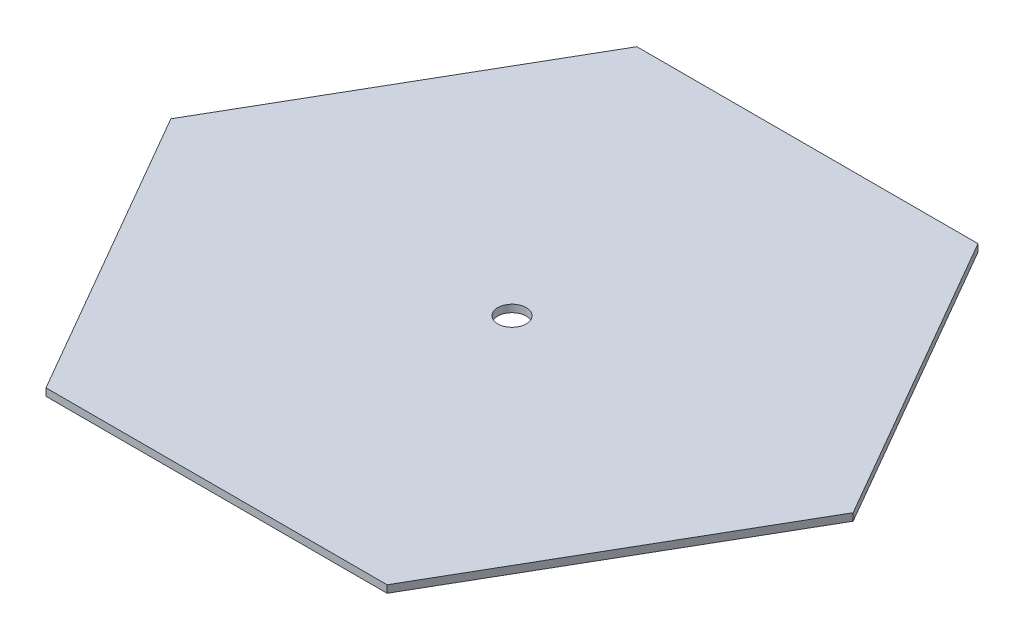
from build123d import *

# Parameters (mm, degrees)
BOSS_EXTRUDE1_DEPTH = 3
SKETCH5_R           = 5.753179175
CUT_EXTRUDE1_DEPTH  = 184.327575667


with BuildPart() as part:
    # Sketch1 → Boss-Extrude1 (new body)
    with BuildSketch(Plane(origin=(0, 0, 0), x_dir=(1, 0, 0), z_dir=(0, 1, 0))):
        Polygon((69.282032303, 120), (-69.282032303, 120), (-138.564064606, 0), (-69.282032303, -120), (69.282032303, -120), (138.564064606, 0), align=None)
    extrude(amount=BOSS_EXTRUDE1_DEPTH)

    # Sketch5 → Cut-Extrude1 (cut, through all)
    with BuildSketch(Plane(origin=(0, 3, 0), x_dir=(1, 0, 0), z_dir=(0, 1, 0))):
        with Locations(Location((0, 0, 0), (0, 0, 270))):
            Circle(SKETCH5_R)
    extrude(amount=-CUT_EXTRUDE1_DEPTH, mode=Mode.SUBTRACT)


solid = part.part
